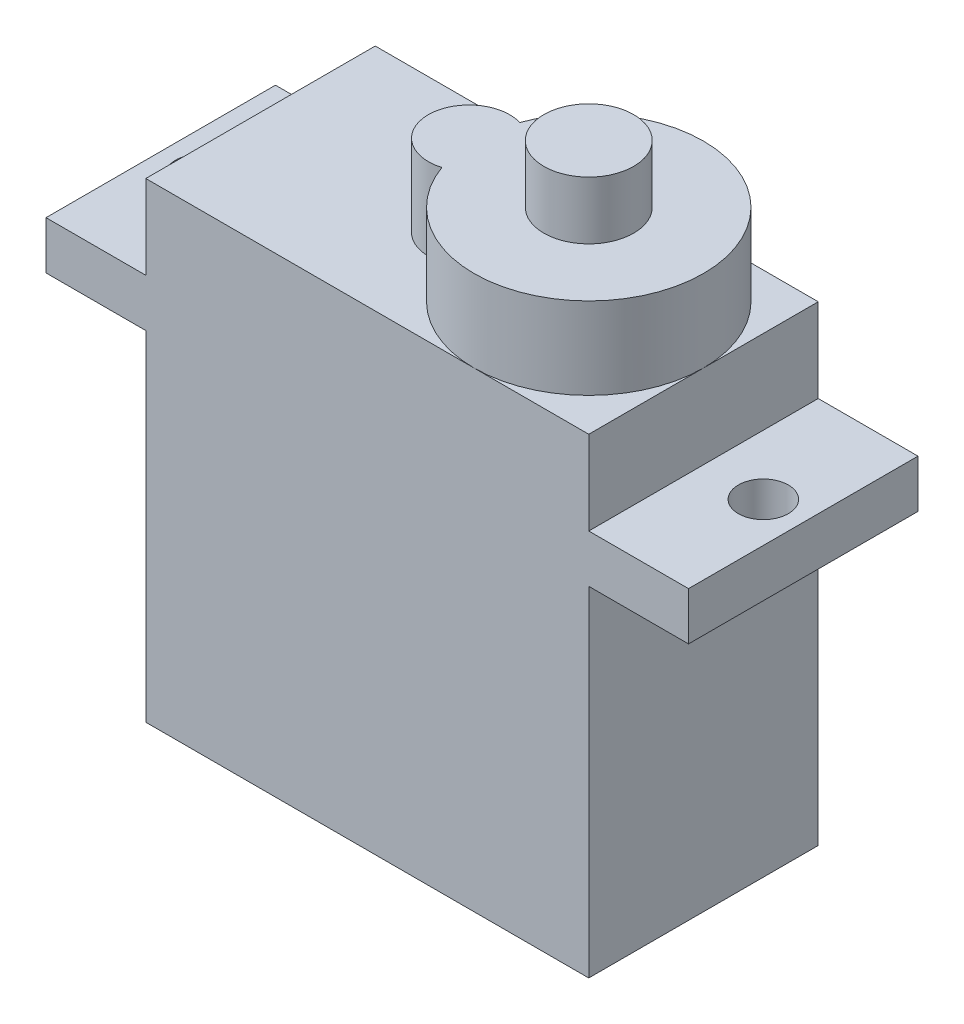
from build123d import *

# Parameters (mm, degrees)
SKETCH2_W           = 22.2
SKETCH2_H           = 23.6
BOSS_EXTRUDE1_DEPTH = 11.5
SKETCH4_W           = 11.5
SKETCH4_H           = 2.4
BOSS_EXTRUDE3_DEPTH = 5
SKETCH5_R           = 1.25
CUT_EXTRUDE1_DEPTH  = 5
SKETCH7_R           = 2.25
BOSS_EXTRUDE4_DEPTH = 4.1
SKETCH7_3_R         = 2.25
BOSS_EXTRUDE5_DEPTH = 7


with BuildPart() as part:
    # Sketch2 → Boss-Extrude1 (new body)
    with BuildSketch(Plane.XY):
        Rectangle(SKETCH2_W, SKETCH2_H)
    extrude(amount=BOSS_EXTRUDE1_DEPTH)

    # Sketch4 → Boss-Extrude3 (add)
    with BuildSketch(Plane(origin=(11.1, 0, 0), x_dir=(0, 0, -1), z_dir=(1, 0, 0))):
        with Locations((-5.75, 6.4)):
            Rectangle(SKETCH4_W, SKETCH4_H)
    boss_extrude3 = extrude(amount=BOSS_EXTRUDE3_DEPTH)

    # Mirror1: Boss-Extrude3 across plane
    add(boss_extrude3.mirror(Plane(origin=(0, 0, 0), x_dir=(0, 0, 1), z_dir=(1, 0, 0))))

    # Sketch5 → Cut-Extrude1 (cut)
    with BuildSketch(Plane(origin=(0, 7.6, 0), x_dir=(1, 0, 0), z_dir=(0, 1, 0))):
        with Locations((14.1, -5.75)):
            Circle(SKETCH5_R)
        with Locations((-14.1, -5.75)):
            Circle(SKETCH5_R)
    extrude(amount=-CUT_EXTRUDE1_DEPTH, mode=Mode.SUBTRACT)

    # Sketch7 → Boss-Extrude4 (add)
    with BuildSketch(Plane(origin=(0, 11.8, 0), x_dir=(1, 0, 0), z_dir=(0, 1, 0))):
        with BuildLine():
            ThreePointArc((-0.05867355, -3.798397984), (-2.689219801, -5.75), (-0.05867355, -7.701602016))
            ThreePointArc((-0.05867355, -7.701602016), (11.1, -5.75), (-0.05867355, -3.798397984))
        make_face()
        with Locations((5.35, -5.75)):
            Circle(SKETCH7_R, mode=Mode.SUBTRACT)
    extrude(amount=BOSS_EXTRUDE4_DEPTH)


with BuildPart() as body_2:
    # Sketch7<3> → Boss-Extrude5 (new body)
    with BuildSketch(Plane(origin=(0, 11.8, 0), x_dir=(1, 0, 0), z_dir=(0, 1, 0))):
        with Locations((5.35, -5.75)):
            Circle(SKETCH7_3_R)
    extrude(amount=BOSS_EXTRUDE5_DEPTH)


solid = Compound([part.part, body_2.part])
